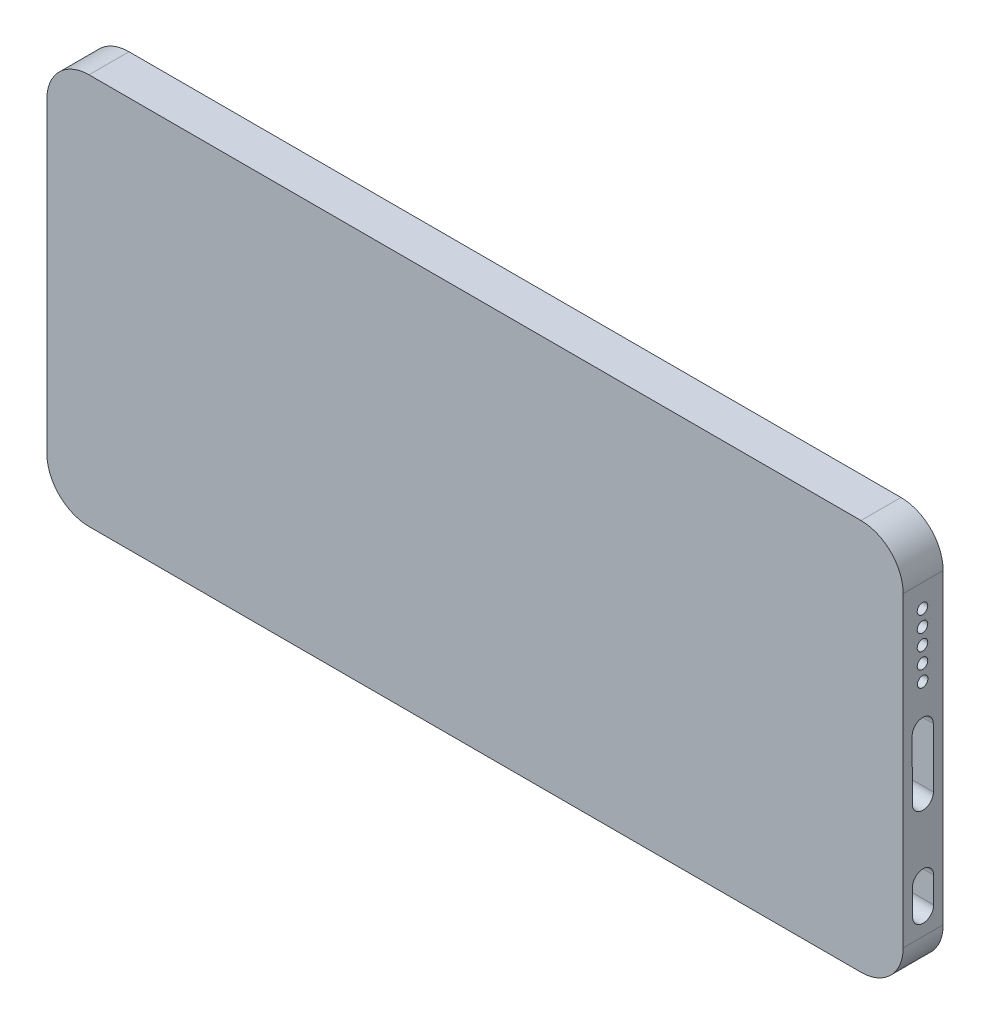
from build123d import *

# Parameters (mm, degrees)
EXTRUDE_1_DEPTH     = 7.58
SKETCH_2_R          = 1
CUT_EXTRUDE_1_DEPTH = 10


with BuildPart() as part:
    # 草图1 → 凸台-拉伸1 (new body)
    with BuildSketch(Plane.XY):
        with BuildLine():
            Line((-77.371685393, 43.405828583), (69.028314607, 43.405828583))
            ThreePointArc((69.028314607, 43.405828583), (74.685168856, 41.062682833), (77.028314607, 35.405828583))
            Line((77.028314607, 35.405828583), (77.028314607, -22.794171417))
            ThreePointArc((77.028314607, -22.794171417), (74.685168856, -28.451025666), (69.028314607, -30.794171417))
            Line((69.028314607, -30.794171417), (-77.371685393, -30.794171417))
            ThreePointArc((-77.371685393, -30.794171417), (-83.028539643, -28.451025666), (-85.371685393, -22.794171417))
            Line((-85.371685393, -22.794171417), (-85.371685393, 35.405828583))
            ThreePointArc((-85.371685393, 35.405828583), (-83.028539643, 41.062682833), (-77.371685393, 43.405828583))
        make_face()
    extrude(amount=EXTRUDE_1_DEPTH)

    # 草图2 → 切除-拉伸1 (cut)
    with BuildSketch(Plane(origin=(77.028314607, 0, 0), x_dir=(0, 0, -1), z_dir=(1, 0, 0))):
        with Locations((-3.91637094, 31.096940443)):
            Circle(SKETCH_2_R)
        with Locations((-3.91637094, 28.096940443)):
            Circle(SKETCH_2_R)
        with Locations((-3.91637094, 25.096940443)):
            Circle(SKETCH_2_R)
        with Locations((-3.91637094, 22.096940443)):
            Circle(SKETCH_2_R)
        with Locations((-3.888231768, 19.096940443)):
            Circle(SKETCH_2_R)
        with BuildLine():
            Line((-1.869713351, 11.20207357), (-1.843333719, -0.047567419))
            ThreePointArc((-1.843333719, -0.047567419), (-3.838638371, -2.05225177), (-5.843322722, -0.056947118))
            Line((-5.843322722, -0.056947118), (-5.869702354, 11.192693871))
            ThreePointArc((-5.869702354, 11.192693871), (-3.874397702, 13.197378222), (-1.869713351, 11.20207357))
        make_face()
        with BuildLine():
            Line((-1.811351016, -13.686647662), (-1.799774442, -18.623498185))
            ThreePointArc((-1.799774442, -18.623498185), (-3.795079095, -20.628182535), (-5.799763445, -18.632877883))
            Line((-5.799763445, -18.632877883), (-5.811340019, -13.69602736))
            ThreePointArc((-5.811340019, -13.69602736), (-3.816035367, -11.69134301), (-1.811351016, -13.686647662))
        make_face()
    extrude(amount=-CUT_EXTRUDE_1_DEPTH, mode=Mode.SUBTRACT)


solid = part.part
